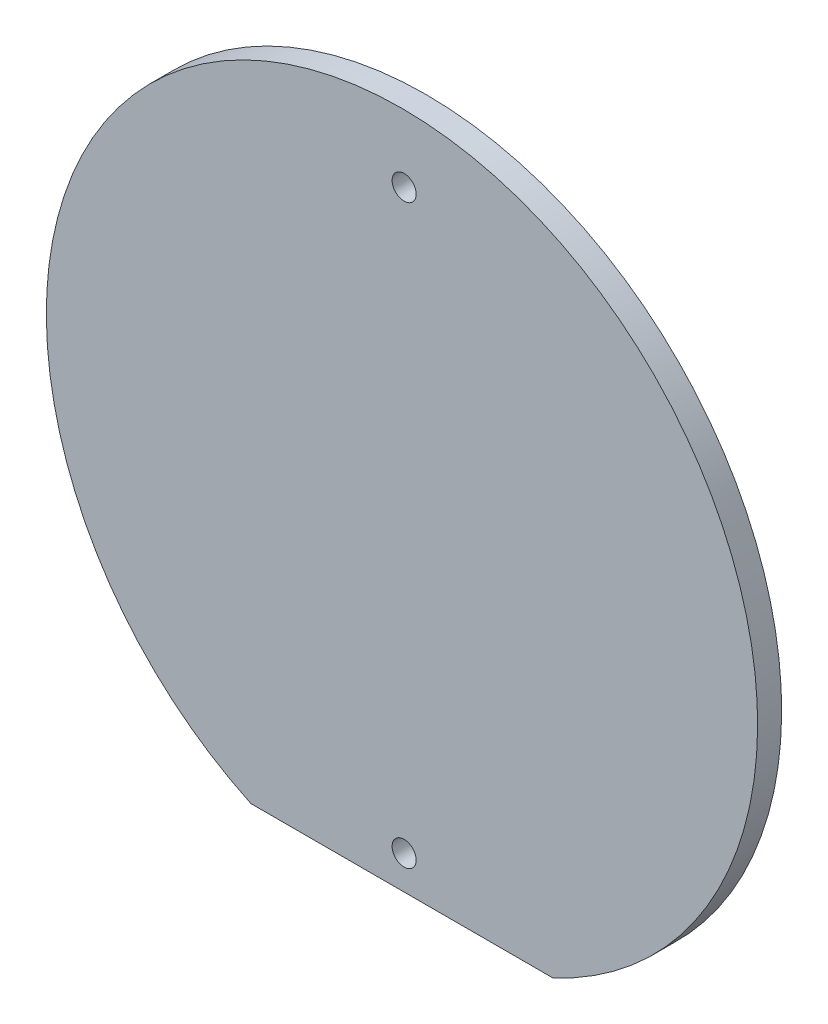
from build123d import *

# Parameters (mm, degrees)
BOSS_EXTRUDE1_DEPTH = 5
SKETCH2_R           = 2.5
CUT_EXTRUDE1_DEPTH  = 10


with BuildPart() as part:
    # Sketch1 → Boss-Extrude1 (new body)
    with BuildSketch(Plane.XY):
        with BuildLine():
            Line((-125.81358794, 5.502409601), (-62.980475651, 5.502409601))
            ThreePointArc((-62.980475651, 5.502409601), (-94.397031795, 146.502409601), (-125.81358794, 5.502409601))
        make_face()
    extrude(amount=BOSS_EXTRUDE1_DEPTH)

    # Sketch2 → Cut-Extrude1 (cut)
    with BuildSketch(Plane.XY.offset(5)):
        with Locations((-93.953395264, 132.502409601)):
            Circle(SKETCH2_R)
        with Locations((-93.953395264, 12.502409601)):
            Circle(SKETCH2_R)
    extrude(amount=-CUT_EXTRUDE1_DEPTH, mode=Mode.SUBTRACT)


solid = part.part
